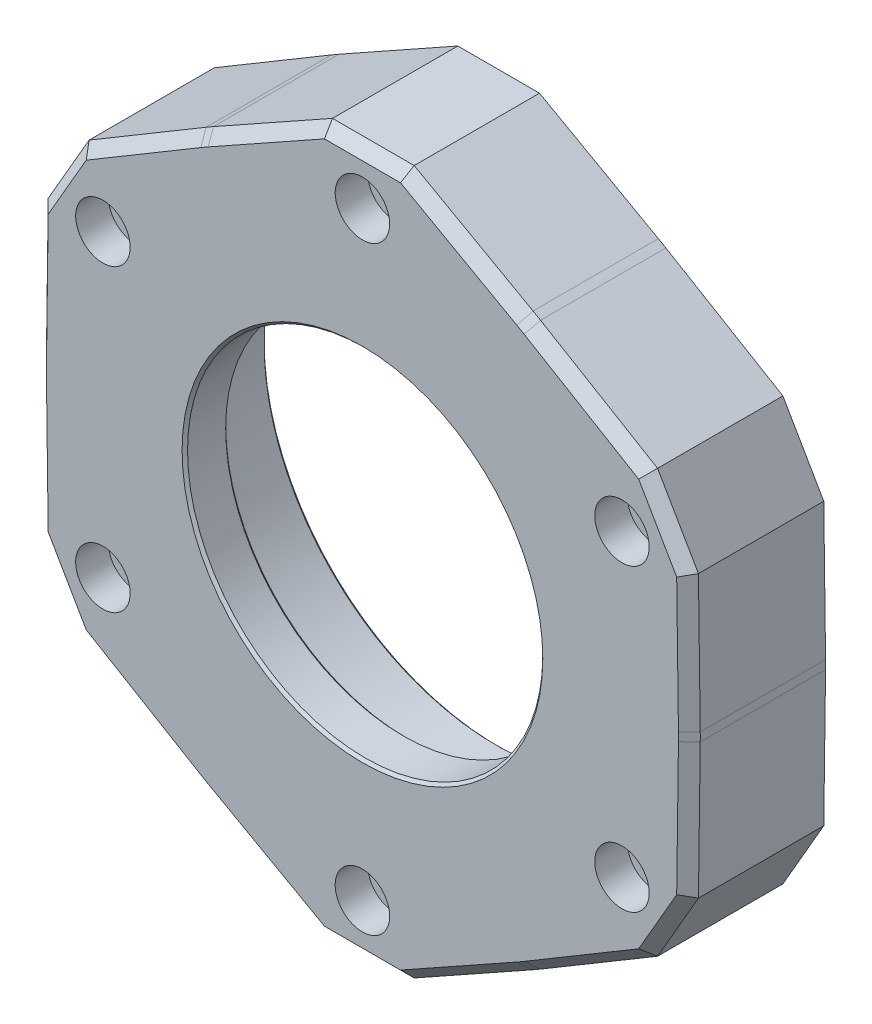
from build123d import *

# Parameters (mm, degrees)
SKETCH1_R           = 60
SKETCH1_R_2         = 2.55
SKETCH1_R_3         = 42.55
BOSS_EXTRUDE1_DEPTH = 25
BOSS_EXTRUDE2_START = -8
SKETCH3_R           = 42.55
SKETCH3_R_2         = 32.6
BOSS_EXTRUDE2_DEPTH = 8
BOSS_EXTRUDE3_DEPTH = 25
SKETCH8_R           = 5
CUT_EXTRUDE1_DEPTH  = 6
CHAMFER2_SIZE       = 0.5
CHAMFER3_SIZE       = 2
SKETCH9_R           = 2.025
CUT_EXTRUDE2_DEPTH  = 7


with BuildPart() as part:
    # Sketch1 → Boss-Extrude1 (new body)
    with BuildSketch(Plane.XY):
        Circle(SKETCH1_R)
        with Locations((0, 55)):
            Circle(SKETCH1_R_2, mode=Mode.SUBTRACT)
        with Locations((47.631397208, 27.5)):
            Circle(SKETCH1_R_2, mode=Mode.SUBTRACT)
        with Locations((47.631397208, -27.5)):
            Circle(SKETCH1_R_2, mode=Mode.SUBTRACT)
        with Locations((0, -55)):
            Circle(SKETCH1_R_2, mode=Mode.SUBTRACT)
        with Locations((-47.631397208, -27.5)):
            Circle(SKETCH1_R_2, mode=Mode.SUBTRACT)
        with Locations((-47.631397208, 27.5)):
            Circle(SKETCH1_R_2, mode=Mode.SUBTRACT)
        Circle(SKETCH1_R_3, mode=Mode.SUBTRACT)
    extrude(amount=BOSS_EXTRUDE1_DEPTH)

    # Sketch3 → Boss-Extrude2 (add)
    with BuildSketch(Plane.XY.offset(25).offset(BOSS_EXTRUDE2_START)):
        Circle(SKETCH3_R)
        Circle(SKETCH3_R_2, mode=Mode.SUBTRACT)
    extrude(amount=BOSS_EXTRUDE2_DEPTH)

    # Sketch7 → Boss-Extrude3 (add)
    with BuildSketch(Plane(origin=(0, 0, 0), x_dir=(-1, 0, 0), z_dir=(0, 0, -1))):
        with BuildLine():
            Line((-29.313322314, 52.351973553), (-7.5, 64.565857851))
            Line((-7.5, 64.565857851), (7.5, 64.565857851))
            Line((7.5, 64.565857851), (29.313322314, 52.351973553))
            ThreePointArc((29.313322314, 52.351973553), (0, 60), (-29.313322314, 52.351973553))
        make_face()
        with BuildLine():
            Line((59.665673116, 25.787738397), (59.994800192, 0.789904984))
            ThreePointArc((59.994800192, 0.789904984), (51.961524227, 30), (30.681477878, 51.56206857))
            Line((30.681477878, 51.56206857), (52.165673116, 38.778119454))
            Line((52.165673116, 38.778119454), (59.665673116, 25.787738397))
        make_face()
        with BuildLine():
            Line((52.165673116, -38.778119454), (30.681477878, -51.56206857))
            ThreePointArc((30.681477878, -51.56206857), (51.961524227, -30), (59.994800192, -0.789904984))
            Line((59.994800192, -0.789904984), (59.665673116, -25.787738397))
            Line((59.665673116, -25.787738397), (52.165673116, -38.778119454))
        make_face()
        with BuildLine():
            Line((-7.5, -64.565857851), (-29.313322314, -52.351973553))
            ThreePointArc((-29.313322314, -52.351973553), (0, -60), (29.313322314, -52.351973553))
            Line((29.313322314, -52.351973553), (7.5, -64.565857851))
            Line((7.5, -64.565857851), (-7.5, -64.565857851))
        make_face()
        with BuildLine():
            Line((-59.665673116, -25.787738397), (-59.994800192, -0.789904984))
            ThreePointArc((-59.994800192, -0.789904984), (-51.961524227, -30), (-30.681477878, -51.56206857))
            Line((-30.681477878, -51.56206857), (-52.165673116, -38.778119454))
            Line((-52.165673116, -38.778119454), (-59.665673116, -25.787738397))
        make_face()
        with BuildLine():
            Line((-52.165673116, 38.778119454), (-30.681477878, 51.56206857))
            ThreePointArc((-30.681477878, 51.56206857), (-51.961524227, 30), (-59.994800192, 0.789904984))
            Line((-59.994800192, 0.789904984), (-59.665673116, 25.787738397))
            Line((-59.665673116, 25.787738397), (-52.165673116, 38.778119454))
        make_face()
    extrude(amount=-BOSS_EXTRUDE3_DEPTH)

    # Sketch8 → Cut-Extrude1 (cut)
    with BuildSketch(Plane.XY.offset(25)):
        with Locations((0, 55)):
            Circle(SKETCH8_R)
        with Locations((47.631397208, 27.5)):
            Circle(SKETCH8_R)
        with Locations((47.631397208, -27.5)):
            Circle(SKETCH8_R)
        with Locations((0, -55)):
            Circle(SKETCH8_R)
        with Locations((-47.631397208, -27.5)):
            Circle(SKETCH8_R)
        with Locations((-47.631397208, 27.5)):
            Circle(SKETCH8_R)
    extrude(amount=-CUT_EXTRUDE1_DEPTH, mode=Mode.SUBTRACT)

    # Chamfer2
    chamfer2_edges = [part.edges().sort_by_distance(p)[0] for p in [
        (-32.6, 0, 17),
        (-32.6, 0, 25),
        (-42.55, 0, 0),
    ]]
    chamfer(chamfer2_edges, length=CHAMFER2_SIZE)

    # Chamfer3
    chamfer3_edges = [part.edges().sort_by_distance(p)[0] for p in [
        (-30, 51.961524227, 25),
        (-18.406661157, 58.458915702, 25),
        (0, 64.565857851, 25),
        (18.406661157, 58.458915702, 25),
        (-60, 0, 25),
        (-59.830236654, 13.28882169, 25),
        (-55.915673116, 32.282928925, 25),
        (-41.423575497, 45.170094012, 25),
        (-30, -51.961524227, 25),
        (-41.423575497, -45.170094012, 25),
        (-55.915673116, -32.282928925, 25),
        (-59.830236654, -13.28882169, 25),
        (30, -51.961524227, 25),
        (18.406661157, -58.458915702, 25),
        (0, -64.565857851, 25),
        (-18.406661157, -58.458915702, 25),
        (60, 0, 25),
        (59.830236654, -13.28882169, 25),
        (55.915673116, -32.282928925, 25),
        (41.423575497, -45.170094012, 25),
        (30, 51.961524227, 25),
        (41.423575497, 45.170094012, 25),
        (55.915673116, 32.282928925, 25),
        (59.830236654, 13.28882169, 25),
    ]]
    chamfer(chamfer3_edges, length=CHAMFER3_SIZE)

    # Sketch9 → Cut-Extrude2 (cut)
    with BuildSketch(Plane(origin=(0, 0, 0), x_dir=(-1, 0, 0), z_dir=(0, 0, -1))):
        with Locations((-8.328166601, 47.231379834)):
            Circle(SKETCH9_R)
        with Locations((8.328166601, 47.231379834)):
            Circle(SKETCH9_R)
        with Locations((23.98, 41.534578366)):
            Circle(SKETCH9_R)
        with Locations((36.739491492, 30.828093761)):
            Circle(SKETCH9_R)
        with Locations((45.067658093, 16.403286074)):
            Circle(SKETCH9_R)
        with Locations((47.96, 0)):
            Circle(SKETCH9_R)
        with Locations((45.067658093, -16.403286074)):
            Circle(SKETCH9_R)
        with Locations((36.739491492, -30.828093761)):
            Circle(SKETCH9_R)
        with Locations((23.98, -41.534578366)):
            Circle(SKETCH9_R)
        with Locations((8.328166601, -47.231379834)):
            Circle(SKETCH9_R)
        with Locations((-8.328166601, -47.231379834)):
            Circle(SKETCH9_R)
        with Locations((-23.98, -41.534578366)):
            Circle(SKETCH9_R)
        with Locations((-36.739491492, -30.828093761)):
            Circle(SKETCH9_R)
        with Locations((-45.067658093, -16.403286074)):
            Circle(SKETCH9_R)
        with Locations((-47.96, 0)):
            Circle(SKETCH9_R)
        with Locations((-45.067658093, 16.403286074)):
            Circle(SKETCH9_R)
        with Locations((-36.739491492, 30.828093761)):
            Circle(SKETCH9_R)
        with Locations((-23.98, 41.534578366)):
            Circle(SKETCH9_R)
    extrude(amount=-CUT_EXTRUDE2_DEPTH, mode=Mode.SUBTRACT)


solid = part.part
